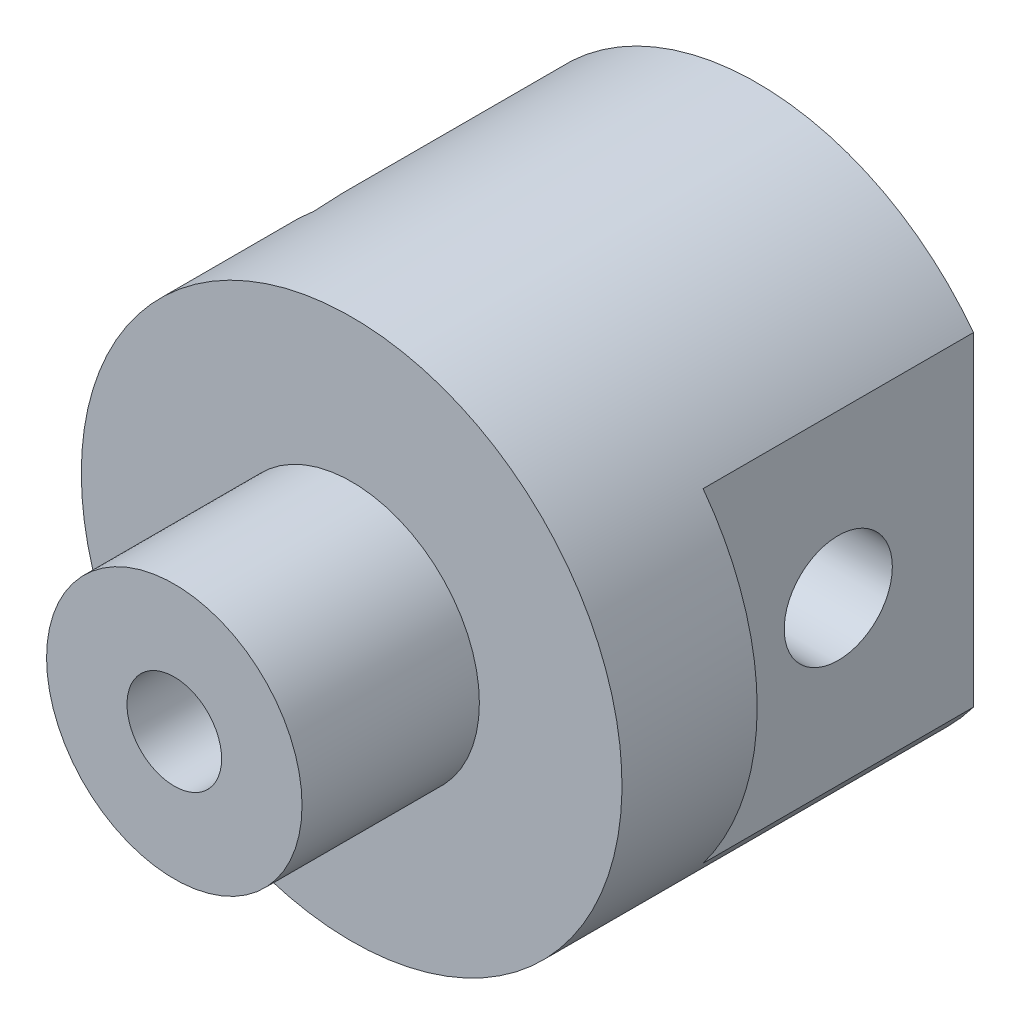
from build123d import *

# Parameters (mm, degrees)
SKETCH1_R               = 4.725
BOSS_EXTRUDE1_DEPTH     = 6.56
SKETCH5_R               = 10
BOSS_EXTRUDE3_DEPTH     = 15
CUT_EXTRUDE1_DEPTH      = 5
CUT_EXTRUDE1_DEPTH_BACK = 15
SKETCH4_W               = 2
SKETCH4_H               = 12
CUT_EXTRUDE2_DEPTH      = 10
CUT_EXTRUDE3_REACH      = 31.813
SKETCH6_R               = 2
SKETCH7_R               = 1.75
CUT_EXTRUDE4_DEPTH      = 26.784367357


with BuildPart() as part:
    # Sketch1 → Boss-Extrude1 (new body)
    with BuildSketch(Plane.XY):
        Circle(SKETCH1_R)
    extrude(amount=-BOSS_EXTRUDE1_DEPTH)

    # Sketch5 → Boss-Extrude3 (add)
    with BuildSketch(Plane(origin=(0, 0, -6.56), x_dir=(-1, 0, 0), z_dir=(0, 0, -1))):
        Circle(SKETCH5_R)
    extrude(amount=BOSS_EXTRUDE3_DEPTH)

    # Sketch3 → Cut-Extrude1 (cut, two sides: drawn at the far end of the back side and taken through both)
    with BuildSketch(Plane(origin=(0, 0, 0), x_dir=(0, 0, -1), z_dir=(1, 0, 0)).offset(-CUT_EXTRUDE1_DEPTH_BACK)):
        Polygon((21.56, -5), (21.56, 5), (11.56, 7.679491924), (11.56, -7.679491924), align=None)
    extrude(amount=CUT_EXTRUDE1_DEPTH + CUT_EXTRUDE1_DEPTH_BACK, mode=Mode.SUBTRACT)

    # Sketch4 → Cut-Extrude2 (cut)
    with BuildSketch(Plane(origin=(0, 0, -21.56), x_dir=(-1, 0, 0), z_dir=(0, 0, -1))):
        with Locations((-9, 0)):
            Rectangle(SKETCH4_W, SKETCH4_H)
    extrude(amount=-CUT_EXTRUDE2_DEPTH, mode=Mode.SUBTRACT)

    # Sketch6 → Cut-Extrude3 (cut, up to next)
    with BuildSketch(Plane(origin=(8, 0, 0), x_dir=(0, 0, -1), z_dir=(1, 0, 0)), mode=Mode.PRIVATE) as cut_extrude3_sk1:
        with Locations((16.56, 0)):
            Circle(SKETCH6_R)
    cut_extrude3_tool1 = extrude(cut_extrude3_sk1.sketch, amount=-CUT_EXTRUDE3_REACH, mode=Mode.PRIVATE) & part.part
    add(cut_extrude3_tool1.solids().sort_by_distance((8, 0, -16.56))[0], mode=Mode.SUBTRACT)

    # Sketch7 → Cut-Extrude4 (cut, through all)
    with BuildSketch(Plane.XY):
        Circle(SKETCH7_R)
    extrude(amount=-CUT_EXTRUDE4_DEPTH, mode=Mode.SUBTRACT)


solid = part.part
